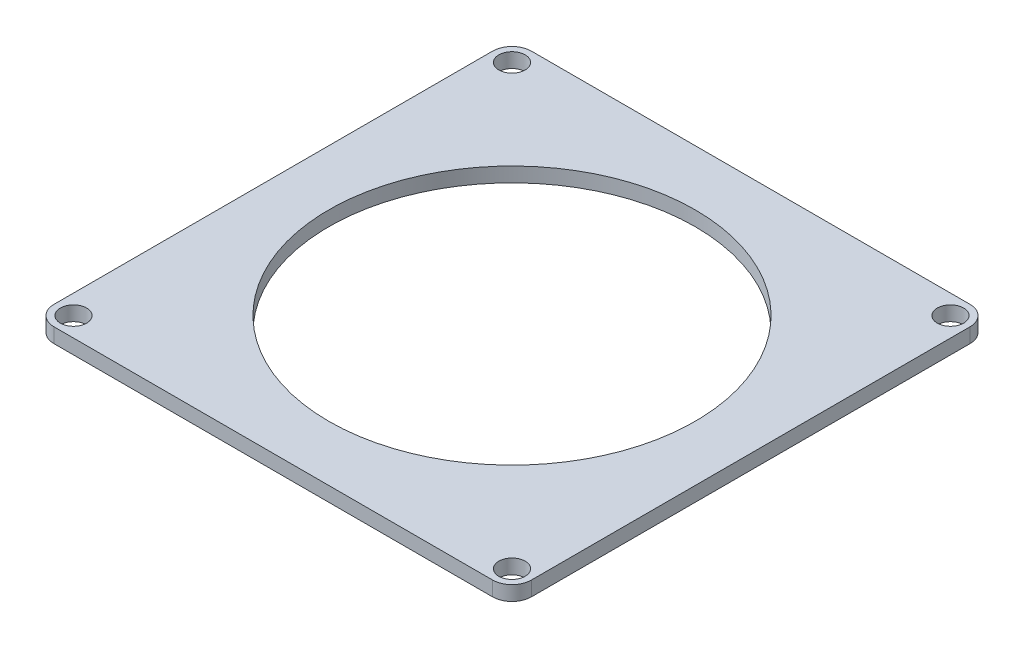
from build123d import *

# Parameters (mm, degrees)
EXTRUDE_1_DEPTH          = 3
SKETCH_2_R               = 37.6
CUT_EXTRUDE_1_DEPTH      = 3
SKETCH_1_4_R             = 2.7
CUT_EXTRUDE_5_DEPTH      = 10
PATTERN_CIRCULAR_2_COUNT = 4


with BuildPart() as part:
    # Эскиз1 → Бобышка-Вытянуть1 (new body)
    with BuildSketch(Plane(origin=(0, 0, 0), x_dir=(1, 0, 0), z_dir=(0, 1, 0))):
        with BuildLine():
            Line((-49, 45), (-49, -45))
            ThreePointArc((-49, -45), (-47.828427125, -47.828427125), (-45, -49))
            Line((-45, -49), (45, -49))
            ThreePointArc((45, -49), (47.828427125, -47.828427125), (49, -45))
            Line((49, -45), (49, 45))
            ThreePointArc((49, 45), (47.828427125, 47.828427125), (45, 49))
            Line((45, 49), (-45, 49))
            ThreePointArc((-45, 49), (-47.828427125, 47.828427125), (-49, 45))
        make_face()
    extrude(amount=EXTRUDE_1_DEPTH)

    # Эскиз2 → Вырез-Вытянуть1 (cut)
    with BuildSketch(Plane(origin=(0, 3, 0), x_dir=(1, 0, 0), z_dir=(0, 1, 0))):
        Circle(SKETCH_2_R)
    extrude(amount=-CUT_EXTRUDE_1_DEPTH, mode=Mode.SUBTRACT)

    # Эскиз1<4> → Вырез-Вытянуть5 (cut)
    with BuildSketch(Plane(origin=(0, 0, 0), x_dir=(1, 0, 0), z_dir=(0, 1, 0))):
        with Locations((45, -45)):
            Circle(SKETCH_1_4_R)
    cut_extrude_5 = extrude(amount=CUT_EXTRUDE_5_DEPTH, mode=Mode.SUBTRACT)

    # Круговой массив2: Вырез-Вытянуть5 ×4 about axis
    pattern_circular_2_axis = Axis((0, 0, 0), (0, 1, 0))
    for i in range(1, PATTERN_CIRCULAR_2_COUNT):
        add(cut_extrude_5.rotate(pattern_circular_2_axis, i * 360 / PATTERN_CIRCULAR_2_COUNT), mode=Mode.SUBTRACT)


solid = part.part
